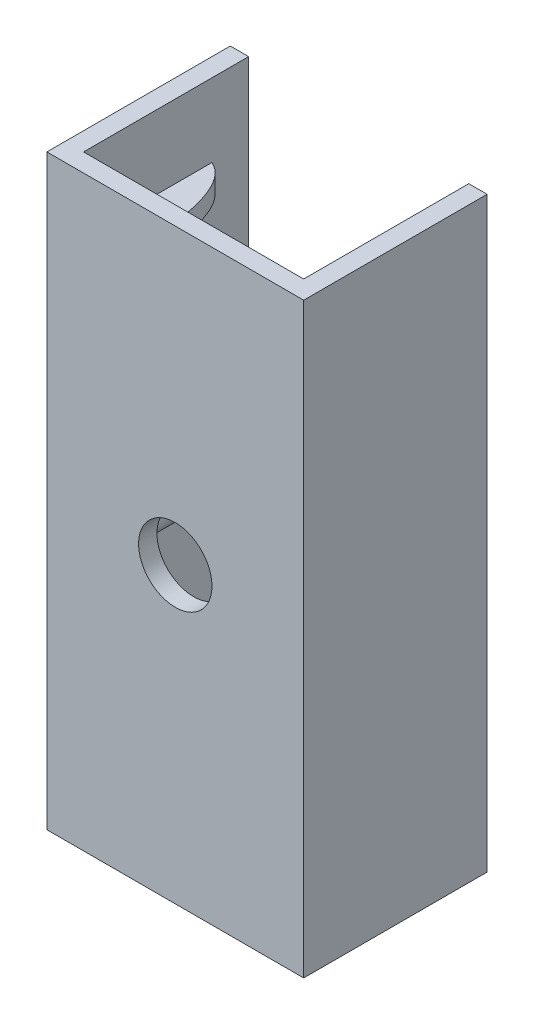
from build123d import *

# Parameters (mm, degrees)
CROQUIS1_W                   = 14000
CROQUIS1_H                   = 32000
CROQUIS1_R                   = 2000
SALIENTE_EXTRUIR1_DEPTH      = 1000
SALIENTE_EXTRUIR2_DEPTH      = 10000
SALIENTE_EXTRUIR3_DEPTH      = 500
SALIENTE_EXTRUIR3_DEPTH_BACK = 500
SALIENTE_EXTRUIR4_DEPTH      = 500
SALIENTE_EXTRUIR4_DEPTH_BACK = 500


with BuildPart() as part:
    # Croquis1 → Saliente-Extruir1 (new body)
    with BuildSketch(Plane.XY):
        with Locations((124743.416897498, 168337.836627923)):
            Rectangle(CROQUIS1_W, CROQUIS1_H)
        with Locations((124743.416897498, 168337.836627923)):
            Circle(CROQUIS1_R, mode=Mode.SUBTRACT)
    extrude(amount=-SALIENTE_EXTRUIR1_DEPTH)

    # Croquis1<6> → Saliente-Extruir2 (add)
    with BuildSketch(Plane.XY):
        with BuildLine():
            Line((117743.416897498, 152337.836627923), (118743.416897498, 152337.836627923))
            Line((118743.416897498, 152337.836627923), (118743.416897498, 166437.836627923))
            Line((118743.416897498, 166437.836627923), (120243.416897498, 166437.836627923))
            ThreePointArc((120243.416897498, 166437.836627923), (121233.366391159, 166847.887134262), (121643.416897498, 167837.836627923))
            Line((121643.416897498, 167837.836627923), (121643.416897498, 168837.836627923))
            ThreePointArc((121643.416897498, 168837.836627923), (121233.366391159, 169827.786121585), (120243.416897498, 170237.836627923))
            Line((120243.416897498, 170237.836627923), (118743.416897498, 170237.836627923))
            Line((118743.416897498, 170237.836627923), (118743.416897498, 184337.836627923))
            Line((118743.416897498, 184337.836627923), (117743.416897498, 184337.836627923))
            Line((117743.416897498, 184337.836627923), (117743.416897498, 152337.836627923))
        make_face()
        with BuildLine():
            Line((130743.416897498, 152337.836627923), (131743.416897498, 152337.836627923))
            Line((131743.416897498, 152337.836627923), (131743.416897498, 184337.836627923))
            Line((131743.416897498, 184337.836627923), (130743.416897498, 184337.836627923))
            Line((130743.416897498, 184337.836627923), (130743.416897498, 170237.836627923))
            Line((130743.416897498, 170237.836627923), (129243.416897498, 170237.836627923))
            ThreePointArc((129243.416897498, 170237.836627923), (128253.467403837, 169827.786121585), (127843.416897498, 168837.836627923))
            Line((127843.416897498, 168837.836627923), (127843.416897498, 167837.836627923))
            ThreePointArc((127843.416897498, 167837.836627923), (128253.467403837, 166847.887134262), (129243.416897498, 166437.836627923))
            Line((129243.416897498, 166437.836627923), (130743.416897498, 166437.836627923))
            Line((130743.416897498, 166437.836627923), (130743.416897498, 152337.836627923))
        make_face()
    extrude(amount=-SALIENTE_EXTRUIR2_DEPTH)

    # Croquis2 → Saliente-Extruir3 (add, two sides: drawn at the far end of the back side and taken through both)
    with BuildSketch(Plane(origin=(0, 156837.836627923, 0), x_dir=(1, 0, 0), z_dir=(0, 1, 0)).offset(-SALIENTE_EXTRUIR3_DEPTH_BACK)):
        with BuildLine():
            add(Edge.make_bspline(
                [(118743.416897498, 8000), (120739.811138244, 7120.578794783), (120743.416897498, 1000)],
                knots=[0, 0, 0, 0.514460755, 0.514460755, 0.514460755], degree=2))
            Line((118743.416897498, 8000), (118743.416897498, 1000))
            Line((118743.416897498, 1000), (120743.416897498, 1000))
        make_face()
        with BuildLine():
            Line((130743.416897498, 1000), (130743.416897498, 8000))
            add(Edge.make_bspline(
                [(130743.416897498, 8000), (128761.675222051, 7234.348262256), (128743.416897498, 1000)],
                knots=[0, 0, 0, 0.590989184, 0.590989184, 0.590989184], degree=2))
            Line((128743.416897498, 1000), (130743.416897498, 1000))
        make_face()
    extrude(amount=SALIENTE_EXTRUIR3_DEPTH + SALIENTE_EXTRUIR3_DEPTH_BACK)

    # Croquis3 → Saliente-Extruir4 (add, two sides: drawn at the far end of the back side and taken through both)
    with BuildSketch(Plane(origin=(0, 179837.836627923, 0), x_dir=(1, 0, 0), z_dir=(0, 1, 0)).offset(-SALIENTE_EXTRUIR4_DEPTH_BACK)):
        with BuildLine():
            add(Edge.make_bspline(
                [(130743.416897498, 8000), (128761.675222051, 7234.348262256), (128743.416897498, 1000)],
                knots=[0, 0, 0, 1, 1, 1], degree=2))
            Line((128743.416897498, 1000), (130743.416897498, 1000))
            Line((130743.416897498, 1000), (130743.416897498, 8000))
        make_face()
        with BuildLine():
            Line((118743.416897498, 8000), (118743.416897498, 1000))
            Line((118743.416897498, 1000), (120743.416897498, 1000))
            add(Edge.make_bspline(
                [(118743.416897498, 8000), (120739.811138244, 7120.578794783), (120743.416897498, 1000)],
                knots=[0, 0, 0, 1, 1, 1], degree=2))
        make_face()
    extrude(amount=SALIENTE_EXTRUIR4_DEPTH + SALIENTE_EXTRUIR4_DEPTH_BACK)


solid = part.part
